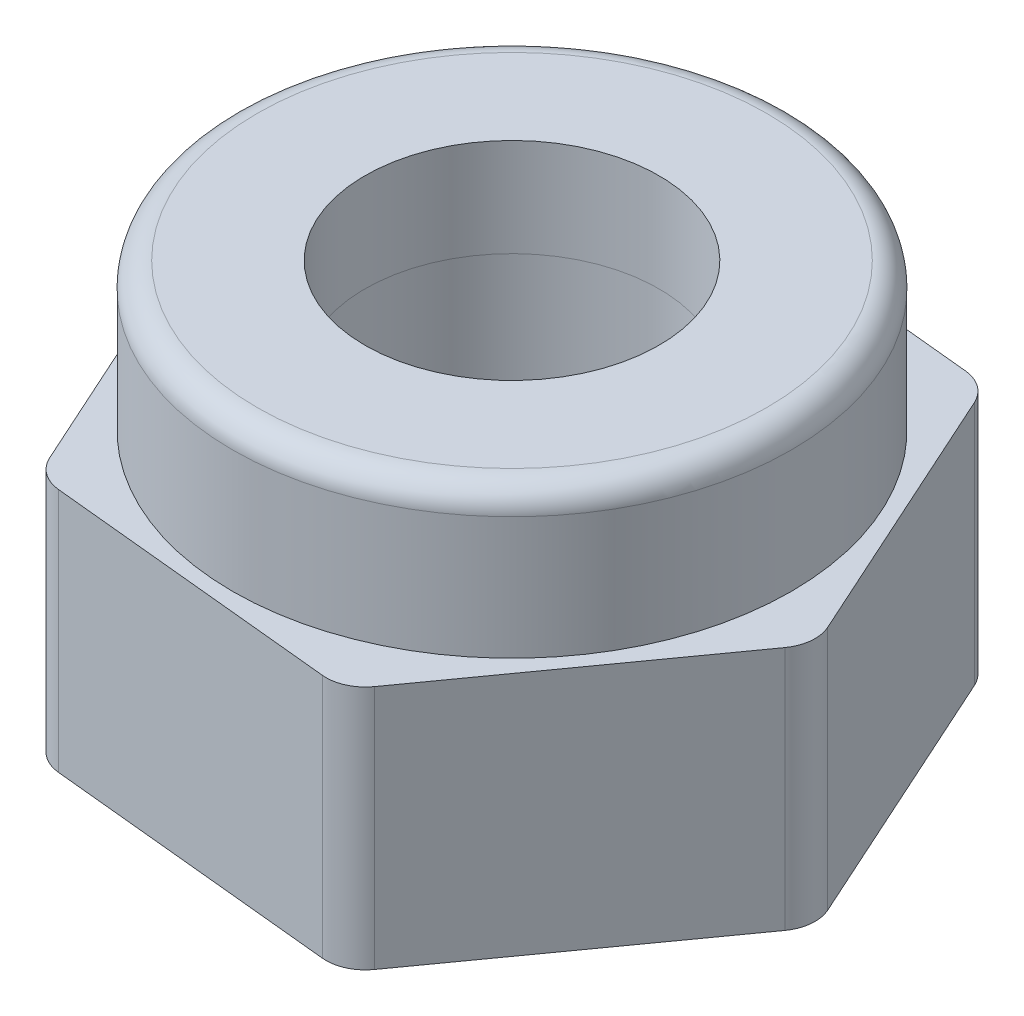
from build123d import *

# Parameters (mm, degrees)
BOSS_EXTRUDE1_DEPTH = 2.5
FILLET1_R           = 0.4
SKETCH2_R           = 2.85
BOSS_EXTRUDE2_DEPTH = 1.5
FILLET2_R           = 0.25
SKETCH5_R           = 2.6
SKETCH5_R_2         = 1.25
CUT_EXTRUDE2_DEPTH  = 1
SKETCH6_R           = 2.6
BOSS_EXTRUDE6_DEPTH = 1
SKETCH7_R           = 1.5
CUT_EXTRUDE3_DEPTH  = 7.107776145


with BuildPart() as part:
    # Sketch1 → Boss-Extrude1 (new body)
    with BuildSketch(Plane(origin=(0, 0, 0), x_dir=(1, 0, 0), z_dir=(0, 1, 0))):
        Polygon((1.428472824, -3.155862068), (3.447293134, -0.34083728), (2.01882031, 2.815024788), (-1.428472824, 3.155862068), (-3.447293134, 0.34083728), (-2.01882031, -2.815024788), align=None)
    extrude(amount=BOSS_EXTRUDE1_DEPTH)

    # Fillet1
    fillet1_edges = [part.edges().sort_by_distance(p)[0] for p in [
        (-2.01882031, 1.25, 2.815024788),
        (-3.447293134, 1.25, -0.34083728),
        (-1.428472824, 1.25, -3.155862068),
        (2.01882031, 1.25, -2.815024788),
        (3.447293134, 1.25, 0.34083728),
        (1.428472824, 1.25, 3.155862068),
    ]]
    fillet(fillet1_edges, radius=FILLET1_R)

    # Sketch2 → Boss-Extrude2 (add)
    with BuildSketch(Plane(origin=(0, 2.5, 0), x_dir=(1, 0, 0), z_dir=(0, 1, 0))):
        with Locations(Location((0, 0, 0), (0, 0, 270))):
            Circle(SKETCH2_R)
    extrude(amount=BOSS_EXTRUDE2_DEPTH)

    # Fillet2
    fillet2_edges = [part.edges().sort_by_distance(p)[0] for p in [
        (0, 4, -2.85),
    ]]
    fillet(fillet2_edges, radius=FILLET2_R)

    # Sketch5 → Cut-Extrude2 (cut)
    with BuildSketch(Plane(origin=(0, 4, 0), x_dir=(1, 0, 0), z_dir=(0, 1, 0))):
        with Locations(Location((0, 0, 0), (0, 0, 270))):
            Circle(SKETCH5_R)
        with Locations(Location((0, 0, 0), (0, 0, 270))):
            Circle(SKETCH5_R_2, mode=Mode.SUBTRACT)
    extrude(amount=-CUT_EXTRUDE2_DEPTH, mode=Mode.SUBTRACT)


with BuildPart() as body_2:
    # Sketch6 → Boss-Extrude6 (new body)
    with BuildSketch(Plane(origin=(0, 3, 0), x_dir=(1, 0, 0), z_dir=(0, 1, 0))):
        with Locations(Location((0, 0, 0), (0, 0, 270))):
            Circle(SKETCH6_R)
    extrude(amount=BOSS_EXTRUDE6_DEPTH)


with BuildPart() as cut_extrude3_tool:
    # Sketch7 → Cut-Extrude3 (new, through all)
    with BuildSketch(Plane(origin=(0, 4, 0), x_dir=(1, 0, 0), z_dir=(0, 1, 0))):
        with Locations(Location((0, 0, 0), (0, 0, 270))):
            Circle(SKETCH7_R)
    extrude(amount=-CUT_EXTRUDE3_DEPTH)


with BuildPart() as part_1:
    add(part.part)

    # Cut-Extrude3: cut by cut_extrude3_tool
    add(cut_extrude3_tool.part, mode=Mode.SUBTRACT)


with BuildPart() as body_2_1:
    add(body_2.part)

    # Cut-Extrude3: cut by cut_extrude3_tool
    add(cut_extrude3_tool.part, mode=Mode.SUBTRACT)


solid = Compound([part_1.part, body_2_1.part])
